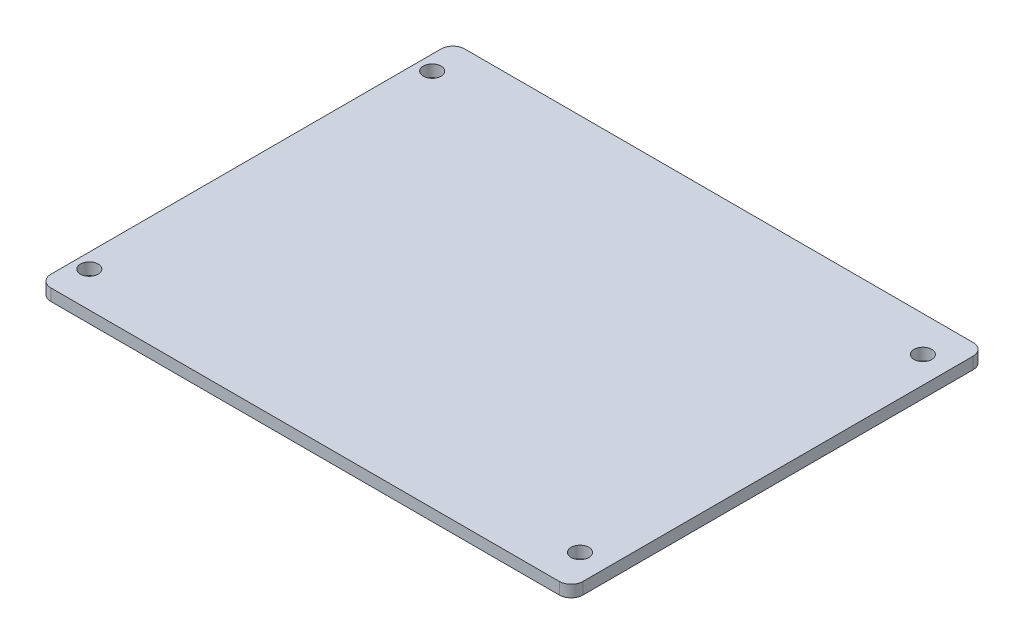
from build123d import *

# Parameters (mm, degrees)
CROQUIS1_W              = 90
CROQUIS1_H              = 70
CROQUIS1_R              = 1.5
SALIENTE_EXTRUIR1_DEPTH = 2
REDONDEO1_R             = 2


with BuildPart() as part:
    # Croquis1 → Saliente-Extruir1 (new body)
    with BuildSketch(Plane(origin=(0, 0, 0), x_dir=(1, 0, 0), z_dir=(0, 1, 0))):
        Rectangle(CROQUIS1_W, CROQUIS1_H)
        with Locations(Location((-42.5, -29, 0), (0, 0, 270))):
            Circle(CROQUIS1_R, mode=Mode.SUBTRACT)
        with Locations(Location((-42.5, 29, 0), (0, 0, 270))):
            Circle(CROQUIS1_R, mode=Mode.SUBTRACT)
        with Locations(Location((40.5, -29, 0), (0, 0, 270))):
            Circle(CROQUIS1_R, mode=Mode.SUBTRACT)
        with Locations(Location((40.5, 29, 0), (0, 0, 270))):
            Circle(CROQUIS1_R, mode=Mode.SUBTRACT)
    extrude(amount=SALIENTE_EXTRUIR1_DEPTH)

    # Redondeo1
    redondeo1_edges = [part.edges().sort_by_distance(p)[0] for p in [
        (-45, 1, -35),
        (45, 1, -35),
        (45, 1, 35),
        (-45, 1, 35),
    ]]
    fillet(redondeo1_edges, radius=REDONDEO1_R)


solid = part.part
